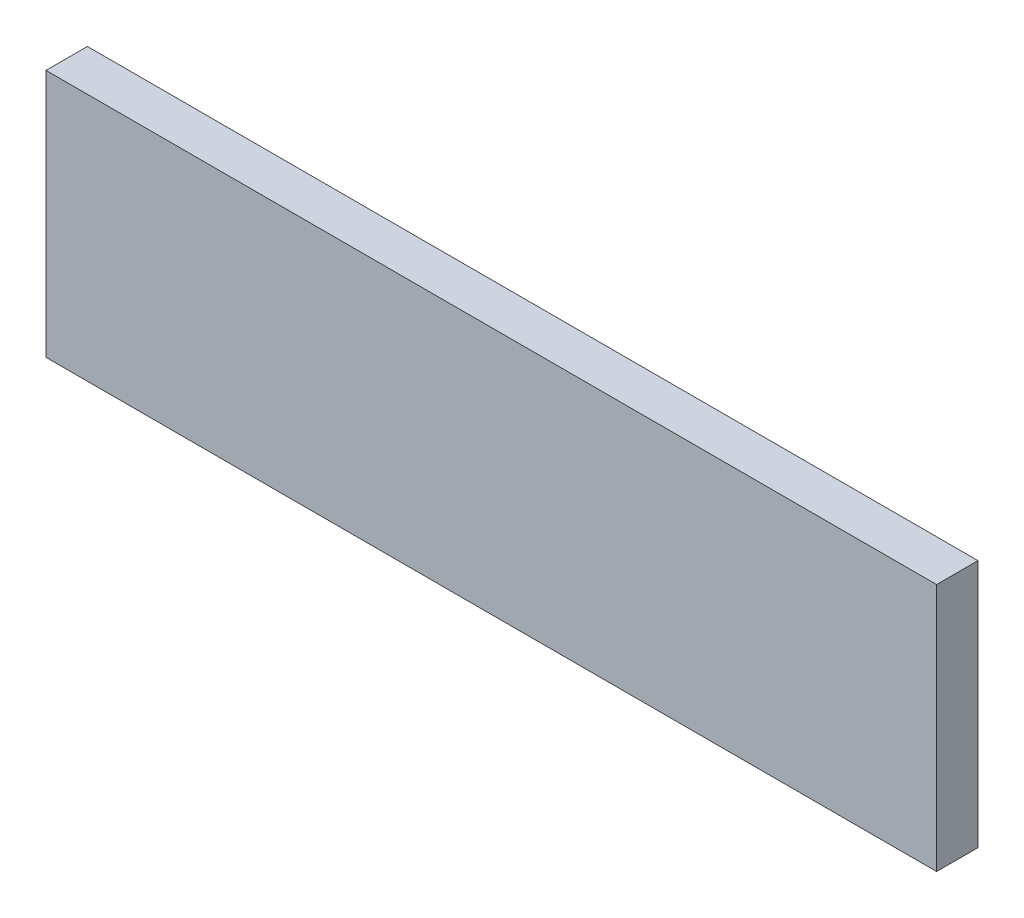
from build123d import *

# Parameters (mm, degrees)
SKETCH1_W           = 50.8
SKETCH1_H           = 304.8
BOSS_EXTRUDE1_DEPTH = 1092.2


with BuildPart() as part:
    # Sketch1 → Boss-Extrude1 (new body)
    with BuildSketch(Plane(origin=(0, 0, 0), x_dir=(0, 0, -1), z_dir=(1, 0, 0))):
        with Locations((25.4, 152.4)):
            Rectangle(SKETCH1_W, SKETCH1_H)
    extrude(amount=BOSS_EXTRUDE1_DEPTH)


solid = part.part
